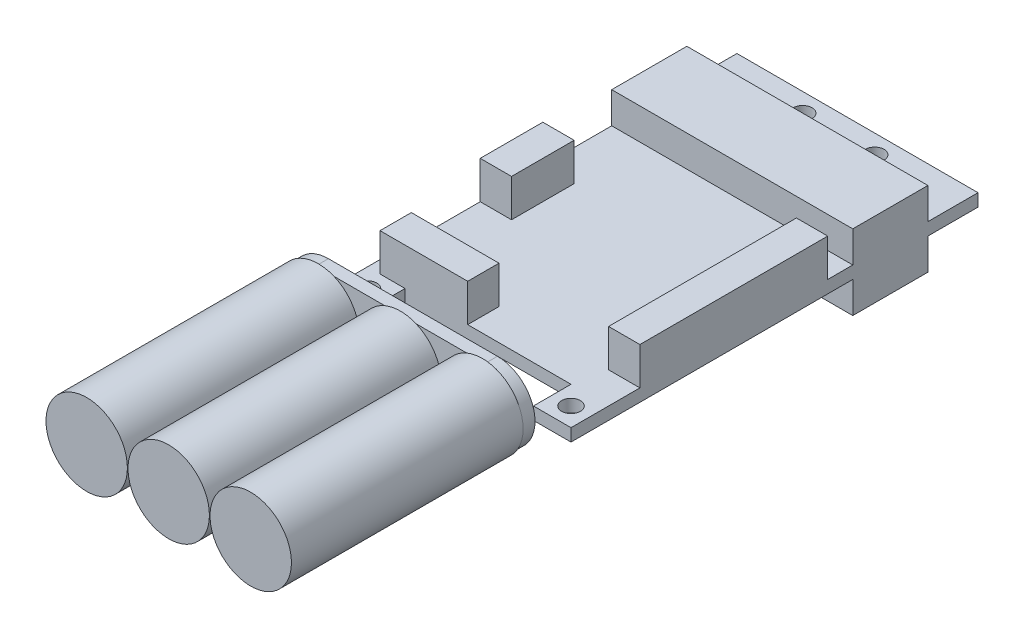
from build123d import *

# Parameters (mm, degrees)
SKETCH_1_W          = 38.5
SKETCH_1_H          = 59
SKETCH_1_W_2        = 6
SKETCH_1_H_2        = 6
EXTRUDE_1_DEPTH     = 2
SKETCH_2_R          = 1.5
CUT_EXTRUDE_1_DEPTH = 41.432814644
SKETCH_3_W          = 5
SKETCH_3_H          = 30
SKETCH_3_H_2        = 10
SKETCH_3_W_2        = 14
SKETCH_3_H_3        = 5
EXTRUDE_2_DEPTH     = 6
SKETCH_4_W          = 38.5
SKETCH_4_H          = 12
EXTRUDE_3_DEPTH     = 5
SKETCH_5_W          = 38.5
SKETCH_5_H          = 12
EXTRUDE_4_DEPTH     = 5
EXTRUDE_5_DEPTH     = 2
SKETCH_7_R          = 6.5
EXTRUDE_7_DEPTH     = 37


with BuildPart() as part:
    # 스케치1 → 보스-돌출1 (new body)
    with BuildSketch(Plane(origin=(0, 0, 0), x_dir=(1, 0, 0), z_dir=(0, 1, 0))):
        Rectangle(SKETCH_1_W, SKETCH_1_H)
        with Locations((-16.25, -32.5)):
            Rectangle(SKETCH_1_W_2, SKETCH_1_H_2)
        with Locations((16.25, -32.5)):
            Rectangle(SKETCH_1_W_2, SKETCH_1_H_2)
    extrude(amount=EXTRUDE_1_DEPTH)

    # 스케치2 → 컷-돌출1 (cut, through all)
    with BuildSketch(Plane(origin=(0, 2, 0), x_dir=(1, 0, 0), z_dir=(0, 1, 0))):
        with Locations(Location((-16.25, -32.5, 0), (0, 0, 270))):
            Circle(SKETCH_2_R)
        with Locations(Location((5.75, 26.5, 0), (0, 0, 90))):
            Circle(SKETCH_2_R)
        with Locations(Location((-5.75, 26.5, 0), (0, 0, 270))):
            Circle(SKETCH_2_R)
        with Locations(Location((16.25, -32.5, 0), (0, 0, 90))):
            Circle(SKETCH_2_R)
    extrude(amount=-CUT_EXTRUDE_1_DEPTH, mode=Mode.SUBTRACT)

    # 스케치3 → 보스-돌출2 (add)
    with BuildSketch(Plane(origin=(0, 2, 0), x_dir=(1, 0, 0), z_dir=(0, 1, 0))):
        with Locations((16.75, -9.5)):
            Rectangle(SKETCH_3_W, SKETCH_3_H)
        with Locations((-16.75, -6.5)):
            Rectangle(SKETCH_3_W, SKETCH_3_H_2)
        with Locations((-10.25, -27)):
            Rectangle(SKETCH_3_W_2, SKETCH_3_H_3)
    extrude(amount=EXTRUDE_2_DEPTH)

    # 스케치4 → 보스-돌출3 (add)
    with BuildSketch(Plane(origin=(0, 2, 0), x_dir=(1, 0, 0), z_dir=(0, 1, 0))):
        with Locations((0, 15.5)):
            Rectangle(SKETCH_4_W, SKETCH_4_H)
    extrude(amount=EXTRUDE_3_DEPTH)

    # 스케치5 → 보스-돌출4 (add)
    with BuildSketch(Plane.XZ):
        with Locations((0, -15.5)):
            Rectangle(SKETCH_5_W, SKETCH_5_H)
    extrude(amount=EXTRUDE_4_DEPTH)


with BuildPart() as body_2:
    # 스케치6 → 보스-돌출5 (new body)
    with BuildSketch(Plane.XY.offset(41.5)):
        with BuildLine():
            Line((-13.5, 12), (13.5, 12))
            ThreePointArc((13.5, 12), (19.5, 6), (13.5, 0))
            Line((13.5, 0), (-13.5, 0))
            ThreePointArc((-13.5, 0), (-19.5, 6), (-13.5, 12))
        make_face()
    extrude(amount=EXTRUDE_5_DEPTH)

    # 스케치7 → 보스-돌출7 (add)
    with BuildSketch(Plane.XY.offset(43.5)):
        with Locations(Location((-13.1, 6, 0), (0, 0, 292.619864948))):
            Circle(SKETCH_7_R)
        with Locations(Location((0, 6, 0), (0, 0, 112.619864948))):
            Circle(SKETCH_7_R)
        with Locations(Location((13.1, 6, 0), (0, 0, 112.619864948))):
            Circle(SKETCH_7_R)
    extrude(amount=EXTRUDE_7_DEPTH)


solid = Compound([part.part, body_2.part])
